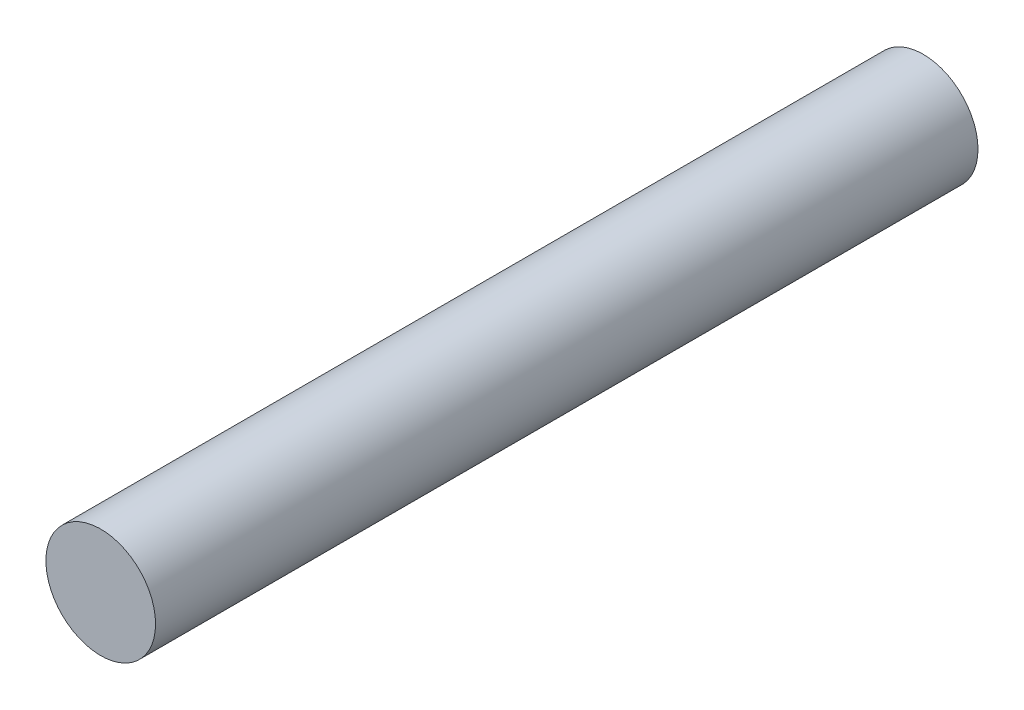
from build123d import *

# Parameters (mm, degrees)
SZKIC1_R                    = 10
DODANIE_WYCI_GNI_CIE1_DEPTH = 150


with BuildPart() as part:
    # Szkic1 → Dodanie-wyciągnięcie1 (new body)
    with BuildSketch(Plane.XY):
        Circle(SZKIC1_R)
    extrude(amount=DODANIE_WYCI_GNI_CIE1_DEPTH)


solid = part.part
